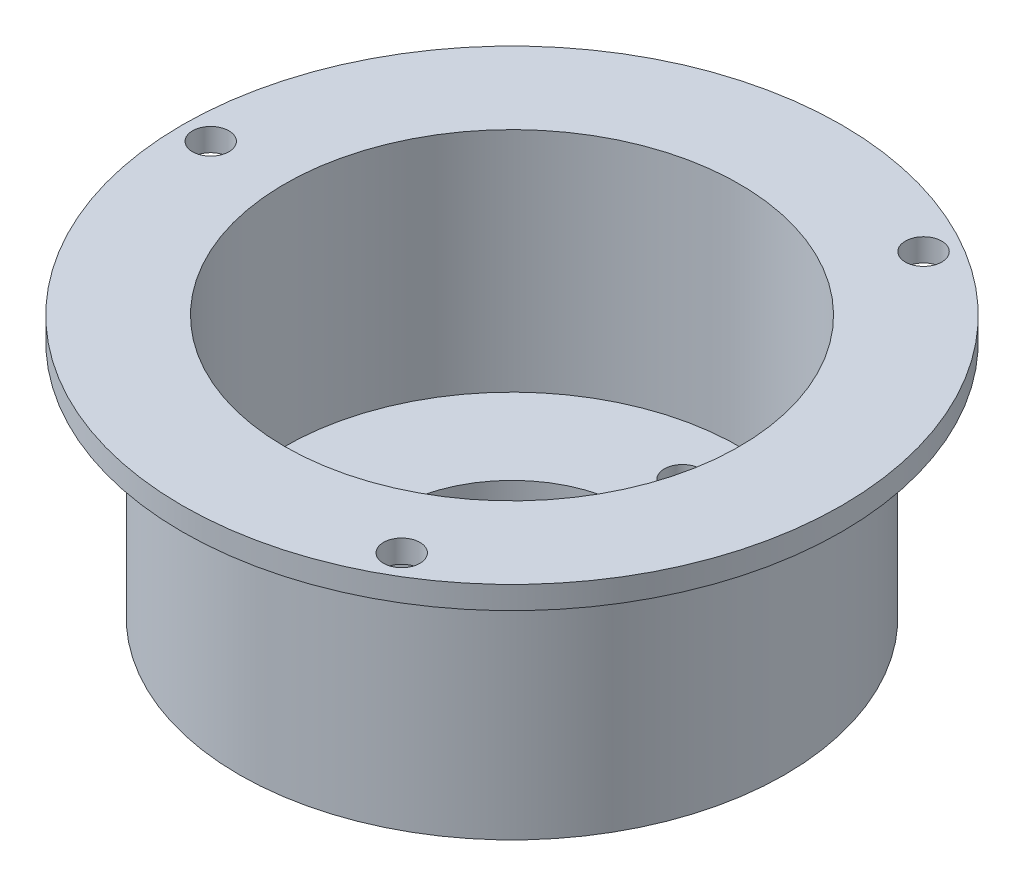
from build123d import *

# Parameters (mm, degrees)
SKETCH1_R           = 24
SKETCH1_R_2         = 20
BOSS_EXTRUDE1_DEPTH = 18
BOSS_EXTRUDE2_START = -3
SKETCH2_R           = 24
SKETCH2_R_2         = 10.5
SKETCH2_R_3         = 1.6
BOSS_EXTRUDE2_DEPTH = 3
SKETCH3_R           = 29
SKETCH3_R_2         = 20
SKETCH3_R_3         = 1.6
BOSS_EXTRUDE3_DEPTH = 2


with BuildPart() as part:
    # Sketch1 → Boss-Extrude1 (new body)
    with BuildSketch(Plane(origin=(0, 0, 0), x_dir=(1, 0, 0), z_dir=(0, 1, 0))):
        with Locations(Location((0, 0, 0), (0, 0, 270))):
            Circle(SKETCH1_R)
        with Locations(Location((0, 0, 0), (0, 0, 270))):
            Circle(SKETCH1_R_2, mode=Mode.SUBTRACT)
    extrude(amount=BOSS_EXTRUDE1_DEPTH)

    # Sketch2 → Boss-Extrude2 (add)
    with BuildSketch(Plane(origin=(0, 0, 0), x_dir=(1, 0, 0), z_dir=(0, 1, 0)).offset(BOSS_EXTRUDE2_START)):
        with Locations(Location((0, 0, 0), (0, 0, 270))):
            Circle(SKETCH2_R)
        with Locations(Location((0, 0, 0), (0, 0, 270))):
            Circle(SKETCH2_R_2, mode=Mode.SUBTRACT)
        with Locations(Location((0, 15, 0), (0, 0, 270))):
            Circle(SKETCH2_R_3, mode=Mode.SUBTRACT)
        with Locations(Location((12.990381057, -7.5, 0), (0, 0, 270))):
            Circle(SKETCH2_R_3, mode=Mode.SUBTRACT)
        with Locations(Location((-12.990381057, -7.5, 0), (0, 0, 270))):
            Circle(SKETCH2_R_3, mode=Mode.SUBTRACT)
    extrude(amount=BOSS_EXTRUDE2_DEPTH)

    # Sketch3 → Boss-Extrude3 (add)
    with BuildSketch(Plane(origin=(0, 18, 0), x_dir=(1, 0, 0), z_dir=(0, 1, 0))):
        with Locations(Location((0, 0, 0), (0, 0, 270))):
            Circle(SKETCH3_R)
        with Locations(Location((0, 0, 0), (0, 0, 270))):
            Circle(SKETCH3_R_2, mode=Mode.SUBTRACT)
        with Locations(Location((-26.5, 0, 0), (0, 0, 270))):
            Circle(SKETCH3_R_3, mode=Mode.SUBTRACT)
        with Locations(Location((13.25, 22.9496732, 0), (0, 0, 270))):
            Circle(SKETCH3_R_3, mode=Mode.SUBTRACT)
        with Locations(Location((13.25, -22.9496732, 0), (0, 0, 270))):
            Circle(SKETCH3_R_3, mode=Mode.SUBTRACT)
    extrude(amount=BOSS_EXTRUDE3_DEPTH)


solid = part.part
